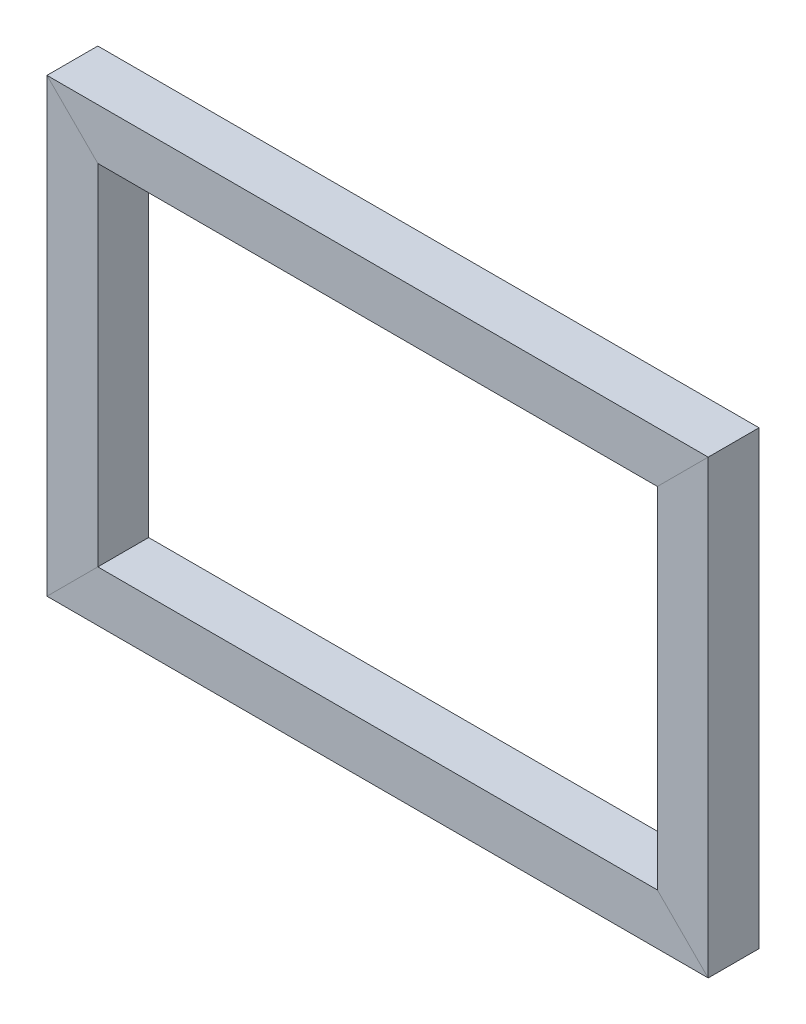
from build123d import *

# Parameters (mm, degrees)
AL_TUBE_SQUARE_2_SQ_X_049_WALL_1_DEPTH      = 436.921024484
AL_TUBE_SQUARE_2_SQ_X_049_WALL_1_DEPTH_BACK = 36.921024484
SKETCH1_W                                   = 50.8
SKETCH1_H                                   = 50.8
SKETCH1_W_2                                 = 48.3108
SKETCH1_H_2                                 = 48.3108
SKETCH1_ON_SEGMENT_2_W                      = 50.8
SKETCH1_ON_SEGMENT_2_H                      = 50.8
SKETCH1_ON_SEGMENT_2_W_2                    = 48.3108
SKETCH1_ON_SEGMENT_2_H_2                    = 48.3108
AL_TUBE_SQUARE_2_SQ_X_049_WALL_1_3_DEPTH    = 683.842048969
SKETCH1_ON_SEGMENT_3_W                      = 50.8
SKETCH1_ON_SEGMENT_3_H                      = 50.8
SKETCH1_ON_SEGMENT_3_W_2                    = 48.3108
SKETCH1_ON_SEGMENT_3_H_2                    = 48.3108
AL_TUBE_SQUARE_2_SQ_X_049_WALL_1_5_DEPTH    = 473.842048969
SKETCH1_ON_SEGMENT_4_W                      = 50.8
SKETCH1_ON_SEGMENT_4_H                      = 50.8
SKETCH1_ON_SEGMENT_4_W_2                    = 48.3108
SKETCH1_ON_SEGMENT_4_H_2                    = 48.3108
AL_TUBE_SQUARE_2_SQ_X_049_WALL_1_7_DEPTH    = 683.842048969


with BuildPart() as part:
    # Sketch1 → Al tube (square) 2 SQ X .049 WALL(1) (new, two sides: drawn at the far end of the back side and taken through both)
    with BuildSketch(Plane(origin=(0, 0, 0), x_dir=(-1, 0, 0), z_dir=(0, 1, 0)).offset(-AL_TUBE_SQUARE_2_SQ_X_049_WALL_1_DEPTH_BACK)):
        Rectangle(SKETCH1_W, SKETCH1_H)
        Rectangle(SKETCH1_W_2, SKETCH1_H_2, mode=Mode.SUBTRACT)
    extrude(amount=AL_TUBE_SQUARE_2_SQ_X_049_WALL_1_DEPTH + AL_TUBE_SQUARE_2_SQ_X_049_WALL_1_DEPTH_BACK)

    # Al tube (square) 2 SQ X .049 WALL(1) mitr
    split(bisect_by=Plane(origin=(0, 0, 0), x_dir=(-0.707106781, -0.707106781, 0), z_dir=(-0.707106781, 0.707106781, 0)), keep=Keep.TOP)

    # Al tube (square) 2 SQ X .049 WALL(1)  2
    split(bisect_by=Plane(origin=(0, 400, 0), x_dir=(0.707106781, -0.707106781, 0), z_dir=(-0.707106781, -0.707106781, 0)), keep=Keep.TOP)


with BuildPart() as body_2:
    # Sketch1 on segment 2 (carried to segment 2) → Al tube (square) 2 SQ X .049 WALL(1)  3 (new body)
    with BuildSketch(Plane(origin=(-36.921024484, 400, 0), x_dir=(0, 1, 0), z_dir=(1, 0, 0))):
        Rectangle(SKETCH1_ON_SEGMENT_2_W, SKETCH1_ON_SEGMENT_2_H)
        Rectangle(SKETCH1_ON_SEGMENT_2_W_2, SKETCH1_ON_SEGMENT_2_H_2, mode=Mode.SUBTRACT)
    extrude(amount=AL_TUBE_SQUARE_2_SQ_X_049_WALL_1_3_DEPTH)

    # Al tube _square_ 2 SQ X .049 WALL_1 3 mi
    split(bisect_by=Plane(origin=(0, 400, 0), x_dir=(-0.707106781, 0.707106781, 0), z_dir=(0.707106781, 0.707106781, 0)), keep=Keep.TOP)

    # Al tube (square) 2 SQ X .049 WALL(1)  4
    split(bisect_by=Plane(origin=(610, 400, 0), x_dir=(-0.707106781, -0.707106781, 0), z_dir=(-0.707106781, 0.707106781, 0)), keep=Keep.TOP)


with BuildPart() as body_3:
    # Sketch1 on segment 3 (carried to segment 3) → Al tube (square) 2 SQ X .049 WALL(1)  5 (new body)
    with BuildSketch(Plane(origin=(610, 436.921024484, 0), x_dir=(1, 0, 0), z_dir=(0, -1, 0))):
        Rectangle(SKETCH1_ON_SEGMENT_3_W, SKETCH1_ON_SEGMENT_3_H)
        Rectangle(SKETCH1_ON_SEGMENT_3_W_2, SKETCH1_ON_SEGMENT_3_H_2, mode=Mode.SUBTRACT)
    extrude(amount=AL_TUBE_SQUARE_2_SQ_X_049_WALL_1_5_DEPTH)

    # Al tube _square_ 2 SQ X .049 WALL_1 5 mi
    split(bisect_by=Plane(origin=(610, 0, 0), x_dir=(-0.707106781, 0.707106781, 0), z_dir=(0.707106781, 0.707106781, 0)), keep=Keep.TOP)

    # Al tube (square) 2 SQ X .049 WALL(1)  6
    split(bisect_by=Plane(origin=(610, 400, 0), x_dir=(0.707106781, 0.707106781, 0), z_dir=(0.707106781, -0.707106781, 0)), keep=Keep.TOP)


with BuildPart() as body_4:
    # Sketch1 on segment 4 (carried to segment 4) → Al tube (square) 2 SQ X .049 WALL(1)  7 (new body)
    with BuildSketch(Plane(origin=(646.921024484, 0, 0), x_dir=(0, -1, 0), z_dir=(-1, 0, 0))):
        Rectangle(SKETCH1_ON_SEGMENT_4_W, SKETCH1_ON_SEGMENT_4_H)
        Rectangle(SKETCH1_ON_SEGMENT_4_W_2, SKETCH1_ON_SEGMENT_4_H_2, mode=Mode.SUBTRACT)
    extrude(amount=AL_TUBE_SQUARE_2_SQ_X_049_WALL_1_7_DEPTH)

    # Al tube _square_ 2 SQ X .049 WALL_1 7 mi
    split(bisect_by=Plane(origin=(0, 0, 0), x_dir=(0.707106781, 0.707106781, 0), z_dir=(0.707106781, -0.707106781, 0)), keep=Keep.TOP)

    # Al tube (square) 2 SQ X .049 WALL(1)  8
    split(bisect_by=Plane(origin=(610, 0, 0), x_dir=(0.707106781, -0.707106781, 0), z_dir=(-0.707106781, -0.707106781, 0)), keep=Keep.TOP)


solid = Compound([part.part, body_2.part, body_3.part, body_4.part])
